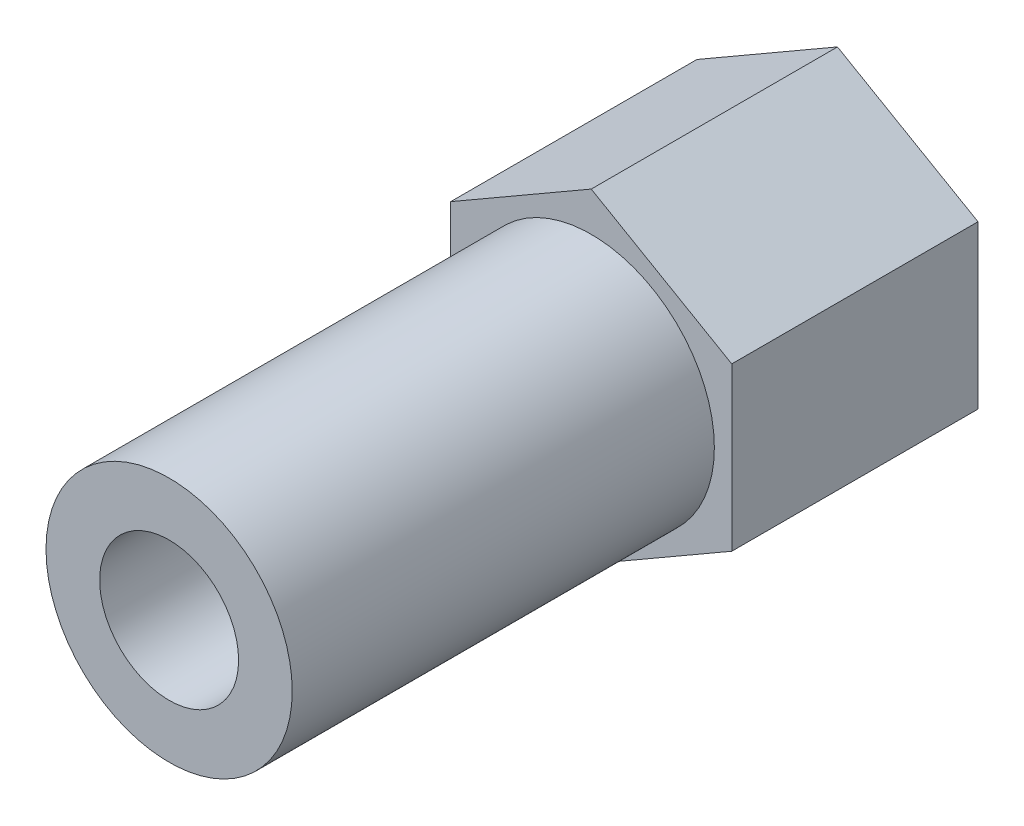
from build123d import *

# Parameters (mm, degrees)
ESBO_O1_R                = 2
RESSALTO_EXTRUS_O1_DEPTH = 7
ESBO_O2_R                = 3.5
RESSALTO_EXTRUS_O2_DEPTH = 12
ESBO_O3_R                = 1.975
CORTE_EXTRUS_O1_DEPTH    = 8


with BuildPart() as part:
    # Esboço1 → Ressalto-extrusão1 (new body)
    with BuildSketch(Plane.XY):
        Polygon((0, 4.613028651), (-3.995, 2.306514325), (-3.995, -2.306514325), (0, -4.613028651), (3.995, -2.306514325), (3.995, 2.306514325), align=None)
        Circle(ESBO_O1_R, mode=Mode.SUBTRACT)
    extrude(amount=RESSALTO_EXTRUS_O1_DEPTH)

    # Esboço2 → Ressalto-extrusão2 (add)
    with BuildSketch(Plane.XY.offset(7)):
        Circle(ESBO_O2_R)
    extrude(amount=RESSALTO_EXTRUS_O2_DEPTH)

    # Esboço3 → Corte-extrusão1 (cut)
    with BuildSketch(Plane.XY.offset(19)):
        Circle(ESBO_O3_R)
    extrude(amount=-CORTE_EXTRUS_O1_DEPTH, mode=Mode.SUBTRACT)


solid = part.part
